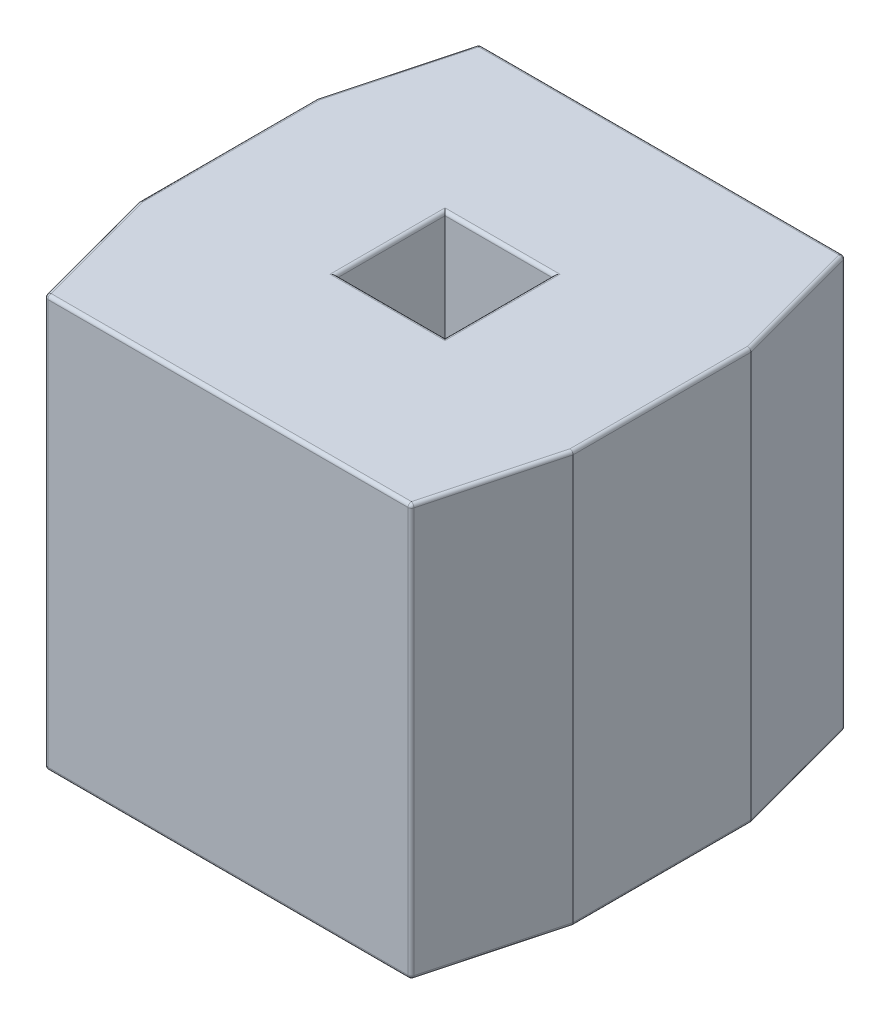
from build123d import *
from OCP.BRepFilletAPI import BRepFilletAPI_MakeChamfer

# Parameters (mm, degrees)
SKETCH1_W           = 2.53
SKETCH1_H           = 2.53
SKETCH1_W_2         = 0.63
SKETCH1_H_2         = 0.63
BOSS_EXTRUDE1_DEPTH = 2.4
CHAMFER1_SIZE       = 0.2
CHAMFER1_SIZE2      = 0.746410162
FILLET1_R           = 0.02


with BuildPart() as part:
    # Sketch1 → Boss-Extrude1 (new body)
    with BuildSketch(Plane(origin=(0, 0, 0), x_dir=(1, 0, 0), z_dir=(0, 1, 0))):
        Rectangle(SKETCH1_W, SKETCH1_H)
        Rectangle(SKETCH1_W_2, SKETCH1_H_2, mode=Mode.SUBTRACT)
    extrude(amount=BOSS_EXTRUDE1_DEPTH)

    # Chamfer1: one chamfer whose edges measure the first distance from different faces: ONE call of the kernel's chamfer builder (chamfer() names one face for all edges)
    chamfer1_edges_1 = [part.edges().sort_by_distance(p)[0] for p in [
        (1.265, 1.2, 1.265),
        (-1.265, 1.2, 1.265),
    ]]
    chamfer1_side_1 = [part.faces().sort_by_distance(p)[0] for p in [
        (0, 1.2, 1.265),
    ]]
    chamfer1_edges_2 = [part.edges().sort_by_distance(p)[0] for p in [
        (-1.265, 1.2, -1.265),
        (1.265, 1.2, -1.265),
    ]]
    chamfer1_side_2 = [part.faces().sort_by_distance(p)[0] for p in [
        (0, 1.2, -1.265),
    ]]
    chamfer1 = BRepFilletAPI_MakeChamfer(part.part.solid().wrapped)
    for e in chamfer1_edges_1:
        chamfer1.Add(CHAMFER1_SIZE, CHAMFER1_SIZE2, e.wrapped, chamfer1_side_1[0].wrapped)  # the first distance lies on this face
    for e in chamfer1_edges_2:
        chamfer1.Add(CHAMFER1_SIZE, CHAMFER1_SIZE2, e.wrapped, chamfer1_side_2[0].wrapped)  # the first distance lies on this face
    add(Compound.cast(chamfer1.Shape()), mode=Mode.REPLACE)

    # Fillet1
    fillet1_edges = [part.edges().sort_by_distance(p)[0] for p in [
        (0.315, 0, 0),
        (0, 0, -0.315),
        (-0.315, 0, 0),
        (0, 0, 0.315),
        (0.315, 2.4, 0),
        (0, 2.4, -0.315),
        (-0.315, 2.4, 0),
        (0, 2.4, 0.315),
        (-1.265, 0, 0),
        (-1.265, 2.4, 0),
        (1.265, 0, 0),
        (0, 0, 1.265),
        (0, 0, -1.265),
        (1.165, 0, 0.891794919),
        (-1.165, 0, 0.891794919),
        (1.165, 0, -0.891794919),
        (-1.165, 0, -0.891794919),
        (0, 2.4, -1.265),
        (1.065, 1.2, -1.265),
        (-1.065, 1.2, -1.265),
        (1.265, 2.4, 0),
        (0, 2.4, 1.265),
        (1.165, 2.4, 0.891794919),
        (-1.165, 2.4, 0.891794919),
        (1.165, 2.4, -0.891794919),
        (-1.165, 2.4, -0.891794919),
        (1.065, 1.2, 1.265),
        (-1.065, 1.2, 1.265),
    ]]
    fillet(fillet1_edges, radius=FILLET1_R)


solid = part.part
